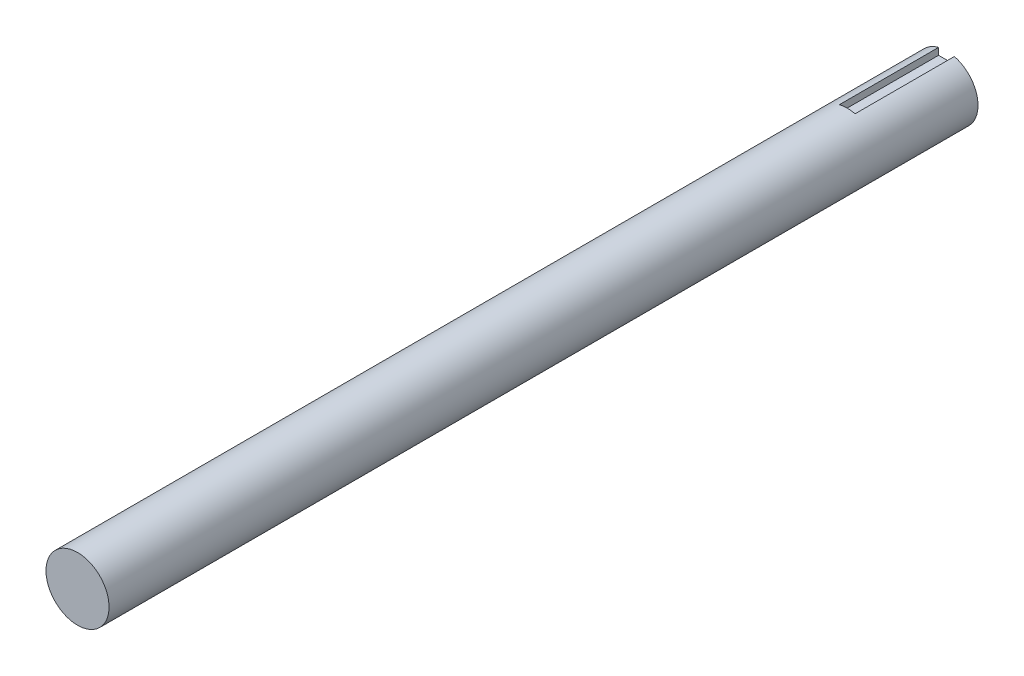
from build123d import *
from build123d.topology import SkipClean

# Parameters (mm, degrees)
CROQUIS1_W              = 25.4
CROQUIS1_H              = 25.4
SALIENTE_EXTRUIR1_DEPTH = 160
CROQUIS3_R              = 19.210047674
CROQUIS3_R_2            = 12.7
CORTAR_EXTRUIR1_DEPTH   = 5
CORTAR_EXTRUIR2_START   = -5
CROQUIS4_R              = 26.335221448
CROQUIS4_R_2            = 12.7
CORTAR_EXTRUIR2_DEPTH   = 5
CROQUIS6_R              = 12.7
SALIENTE_EXTRUIR3_DEPTH = 30
CROQUIS7_W              = 6.35
CROQUIS7_H              = 6.35
CORTAR_EXTRUIR5_DEPTH   = 40
CORTAR_EXTRUIR6_START   = -359
CROQUIS8_R              = 28.219538172
CROQUIS8_R_2            = 12.7
CORTAR_EXTRUIR6_DEPTH   = 359


with BuildPart() as part:
    # Croquis1 → Saliente-Extruir1 (new, symmetric)
    with BuildSketch(Plane.XY):
        Rectangle(CROQUIS1_W, CROQUIS1_H)
    extrude(amount=SALIENTE_EXTRUIR1_DEPTH, both=True)

    # Croquis3 → Cortar-Extruir1 (cut)
    with BuildSketch(Plane.XY.offset(160)):
        Circle(CROQUIS3_R)
        with Locations(Location((0, 0, 0), (0, 0, 180))):
            Circle(CROQUIS3_R_2, mode=Mode.SUBTRACT)
    extrude(amount=-CORTAR_EXTRUIR1_DEPTH, mode=Mode.SUBTRACT)

    # Croquis4 → Cortar-Extruir2 (cut)
    with BuildSketch(Plane(origin=(0, 0, -160), x_dir=(-1, 0, 0), z_dir=(0, 0, -1)).offset(CORTAR_EXTRUIR2_START)):
        Circle(CROQUIS4_R)
        Circle(CROQUIS4_R_2, mode=Mode.SUBTRACT)
    extrude(amount=CORTAR_EXTRUIR2_DEPTH, mode=Mode.SUBTRACT)

    # Croquis6 → Saliente-Extruir3 (add)
    with BuildSketch(Plane(origin=(0, 0, -160), x_dir=(-1, 0, 0), z_dir=(0, 0, -1))):
        Circle(CROQUIS6_R)
    extrude(amount=SALIENTE_EXTRUIR3_DEPTH)

    # Croquis7 → Cortar-Extruir5 (cut)
    with BuildSketch(Plane(origin=(0, 0, -190), x_dir=(-1, 0, 0), z_dir=(0, 0, -1))):
        with Locations((0, 12.7)):
            Rectangle(CROQUIS7_W, CROQUIS7_H)
    extrude(amount=-CORTAR_EXTRUIR5_DEPTH, mode=Mode.SUBTRACT)

    # Croquis8 → Cortar-Extruir6 (cut)
    with SkipClean():  # the faces are left unmerged after this step: merging them gives an invalid solid
        with BuildSketch(Plane(origin=(0, 0, -190), x_dir=(-1, 0, 0), z_dir=(0, 0, -1)).offset(CORTAR_EXTRUIR6_START)):
            Circle(CROQUIS8_R)
            with Locations(Location((0, 0, 0), (0, 0, 104.477512186))):
                Circle(CROQUIS8_R_2, mode=Mode.SUBTRACT)
        extrude(amount=CORTAR_EXTRUIR6_DEPTH, mode=Mode.SUBTRACT)


solid = part.part
